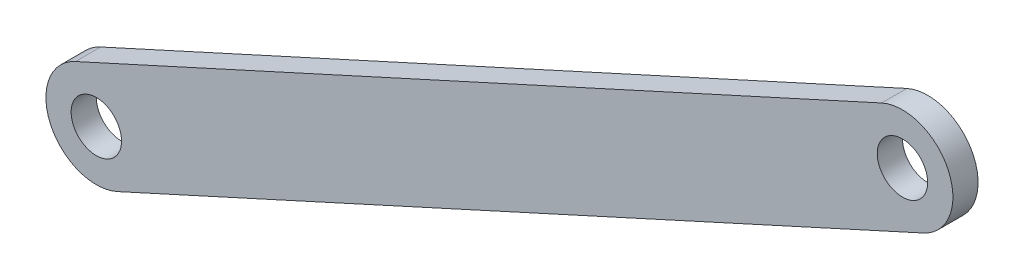
from build123d import *

# Parameters (mm, degrees)
BOSS_EXTRUDE1_START = 1.5875
SKETCH1_R           = 1.5875
BOSS_EXTRUDE1_DEPTH = 1.5875


with BuildPart() as part:
    # Sketch1 → Boss-Extrude1 (new body)
    with BuildSketch(Plane.XY.offset(BOSS_EXTRUDE1_START)):
        with BuildLine():
            Line((-76.110393051, 11.032581248), (-25.329562768, 34.161508497))
            ThreePointArc((-25.329562768, 34.161508497), (-21.124124055, 32.588125125), (-22.697507427, 28.382686413))
            Line((-22.697507427, 28.382686413), (-73.47833771, 5.253759164))
            ThreePointArc((-73.47833771, 5.253759164), (-77.683776423, 6.827142535), (-76.110393051, 11.032581248))
        make_face()
        with Locations((-24.013535097, 31.272097455)):
            Circle(SKETCH1_R, mode=Mode.SUBTRACT)
        with Locations((-74.794365381, 8.143170206)):
            Circle(SKETCH1_R, mode=Mode.SUBTRACT)
    extrude(amount=BOSS_EXTRUDE1_DEPTH)


solid = part.part
